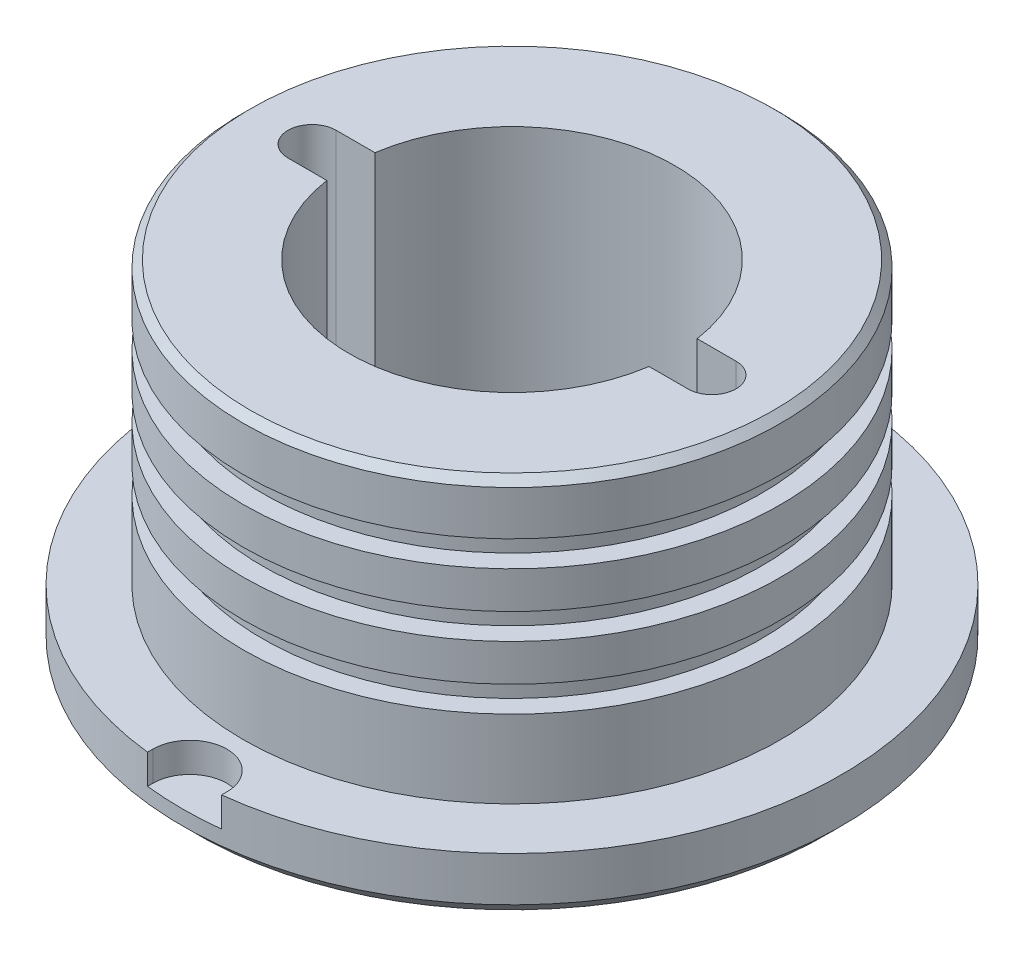
from build123d import *

# Parameters (mm, degrees)
CORTE_EXTRUS_O1_DEPTH      = 4
CHANFRO1_SIZE              = 1
CORTE_EXTRUS_O2_DEPTH      = 78.951908251
CORTE_EXTRUS_O2_DEPTH_BACK = 12
ESBO_O3_R                  = 1.5
CORTE_EXTRUS_O3_START      = -12
ESBO_O3_5_R                = 1.5
CORTE_EXTRUS_O3_DEPTH      = 66.951908251
CHANFRO2_SIZE              = 2
ESBO_O4_R                  = 1.25
CORTE_EXTRUS_O4_DEPTH      = 6
CORTE_EXTRUS_O5_REACH      = 79.952
ESBO_O4_3_R                = 4


with BuildPart() as part:
    # Esboço1 → Revolução1 (revolve)
    with BuildSketch(Plane.XY, mode=Mode.PRIVATE) as revolu_o1_sk:
        Polygon((44.5, 0), (44.5, 8), (36.3, 8), (36.3, 18.5), (33.7, 18.5), (33.7, 22), (36.3, 22), (36.3, 27), (33.7, 27), (33.7, 30.5), (36.3, 30.5), (36.3, 35.5), (33.7, 35.5), (33.7, 39), (36.3, 39), (36.3, 46), (22, 46), (22, 12), (0, 12), (0, 0), align=None)
    revolve(revolu_o1_sk.sketch.rotate(Axis((0, 0, 0), (0, 1, 0)), 90), axis=Axis((0, 0, 0), (0, 1, 0)))

    # Esboço2 → Corte-extrusão1 (cut)
    with BuildSketch(Plane(origin=(0, 8, 0), x_dir=(1, 0, 0), z_dir=(0, 1, 0))):
        with BuildLine():
            Line((5, 45.5), (5, 43.5))
            ThreePointArc((5, 43.5), (0, 38.5), (-5, 43.5))
            Line((-5, 43.5), (-5, 45.5))
            ThreePointArc((-5, 45.5), (0, 50.5), (5, 45.5))
        make_face()
        with BuildLine():
            Line((5, -45.5), (5, -43.5))
            ThreePointArc((5, -43.5), (0, -38.5), (-5, -43.5))
            Line((-5, -43.5), (-5, -45.5))
            ThreePointArc((-5, -45.5), (0, -50.5), (5, -45.5))
        make_face()
    extrude(amount=-CORTE_EXTRUS_O1_DEPTH, mode=Mode.SUBTRACT)

    # Chanfro1
    chanfro1_edges = [part.edges().sort_by_distance(p)[0] for p in [
        (0, 46, 36.3),
    ]]
    chamfer(chanfro1_edges, length=CHANFRO1_SIZE)

    # Esboço3 → Corte-extrusão2 (cut, two sides: drawn at the far end of the back side and taken through both)
    with BuildSketch(Plane.XZ.offset(-CORTE_EXTRUS_O2_DEPTH_BACK)):
        with Locations(Location((-27, 0, 0), (0, 0, 270))):
            Circle(ESBO_O3_R)
        with Locations(Location((27, 0, 0), (0, 0, 270))):
            Circle(ESBO_O3_R)
    extrude(amount=CORTE_EXTRUS_O2_DEPTH + CORTE_EXTRUS_O2_DEPTH_BACK, mode=Mode.SUBTRACT)

    # Esboço3<5> → Corte-extrusão3 (cut, through all)
    # profile 1 of 2: a face of its own
    with BuildSketch(Plane.XZ.offset(CORTE_EXTRUS_O3_START)):
        with BuildLine():
            Line((-27, 3.25), (-21.5, 3.25))
            ThreePointArc((-21.5, 3.25), (-18.25, 0), (-21.5, -3.25))
            Line((-21.5, -3.25), (-27, -3.25))
            ThreePointArc((-27, -3.25), (-30.25, 0), (-27, 3.25))
        make_face()
        with Locations(Location((-27, 0, 0), (0, 0, 270))):
            Circle(ESBO_O3_5_R, mode=Mode.SUBTRACT)
    # profile 2 of 2: a face of its own
    with BuildSketch(Plane.XZ.offset(CORTE_EXTRUS_O3_START)):
        with BuildLine():
            Line((27, 3.25), (21.5, 3.25))
            ThreePointArc((21.5, 3.25), (18.25, 0), (21.5, -3.25))
            Line((21.5, -3.25), (27, -3.25))
            ThreePointArc((27, -3.25), (30.25, 0), (27, 3.25))
        make_face()
        with Locations(Location((27, 0, 0), (0, 0, 270))):
            Circle(ESBO_O3_5_R, mode=Mode.SUBTRACT)
    extrude(amount=-CORTE_EXTRUS_O3_DEPTH, mode=Mode.SUBTRACT)


with BuildPart() as corte_extrus_o3_kept_piece:
    # of the separate pieces the step leaves, the one the design keeps (corte_extrus_o3_pieces_kept)
    add(part.part.solids().sort_by_distance((0, 45, -36.3))[0])

    # Chanfro2
    chanfro2_edges = [corte_extrus_o3_kept_piece.edges().sort_by_distance(p)[0] for p in [
        (0, 0, 44.5),
    ]]
    chamfer(chanfro2_edges, length=CHANFRO2_SIZE)

    # Esboço4 → Corte-extrusão4 (cut)
    with BuildSketch(Plane.XZ):
        with Locations(Location((-8.5, 7, 0), (0, 0, 270))):
            Circle(ESBO_O4_R)
        with Locations(Location((8.5, 7, 0), (0, 0, 270))):
            Circle(ESBO_O4_R)
    extrude(amount=-CORTE_EXTRUS_O4_DEPTH, mode=Mode.SUBTRACT)

    # Esboço4<3> → Corte-extrusão5 (cut, up to next)
    with BuildSketch(Plane.XZ, mode=Mode.PRIVATE) as corte_extrus_o5_sk1:
        with Locations(Location((0, -13, 0), (0, 0, 270))):
            Circle(ESBO_O4_3_R)
    corte_extrus_o5_tool1 = extrude(corte_extrus_o5_sk1.sketch, amount=-CORTE_EXTRUS_O5_REACH, mode=Mode.PRIVATE) & corte_extrus_o3_kept_piece.part
    add(corte_extrus_o5_tool1.solids().sort_by_distance((0, 0, -13))[0], mode=Mode.SUBTRACT)


solid = corte_extrus_o3_kept_piece.part
